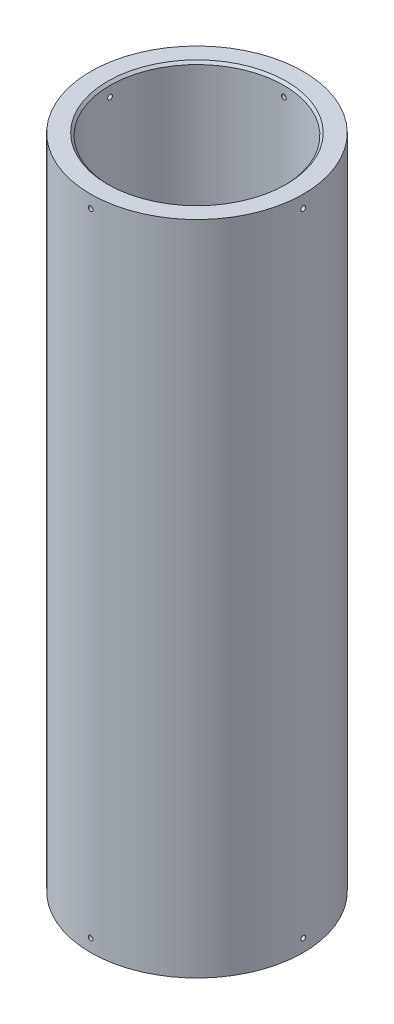
from build123d import *

# Parameters (mm, degrees)
ESBO_O1_R                = 44.5
ESBO_O1_R_2              = 36.4
RESSALTO_EXTRUS_O1_DEPTH = 275
CHANFRO1_SIZE            = 1
ESBO_O5_R                = 1
CORTE_EXTRUS_O3_DEPTH    = 293.448713452
ESBO_O13_R               = 1
CORTE_EXTRUS_O4_DEPTH    = 293.448713592


with BuildPart() as part:
    # Esboço1 → Ressalto-extrusão1 (new body)
    with BuildSketch(Plane(origin=(0, 0, 0), x_dir=(1, 0, 0), z_dir=(0, 1, 0))):
        with Locations(Location((0, 0, 0), (0, 0, 270))):
            Circle(ESBO_O1_R)
        with Locations(Location((0, 0, 0), (0, 0, 270))):
            Circle(ESBO_O1_R_2, mode=Mode.SUBTRACT)
    extrude(amount=RESSALTO_EXTRUS_O1_DEPTH)

    # Chanfro1
    chanfro1_edges = [part.edges().sort_by_distance(p)[0] for p in [
        (0, 0, -36.4),
        (0, 275, -36.4),
    ]]
    chamfer(chanfro1_edges, length=CHANFRO1_SIZE)

    # Esboço5 → Corte-extrusão3 (cut, through all)
    with BuildSketch(Plane.XY.offset(44.5)):
        with Locations((0, 269.75)):
            Circle(ESBO_O5_R)
        with Locations((0, 5.25)):
            Circle(ESBO_O5_R)
    extrude(amount=-CORTE_EXTRUS_O3_DEPTH, mode=Mode.SUBTRACT)

    # Esboço13 → Corte-extrusão4 (cut, through all)
    with BuildSketch(Plane.ZY.offset(44.5)):
        with Locations((0, 5.25)):
            Circle(ESBO_O13_R)
        with Locations((0, 269.75)):
            Circle(ESBO_O13_R)
    extrude(amount=-CORTE_EXTRUS_O4_DEPTH, mode=Mode.SUBTRACT)


solid = part.part
